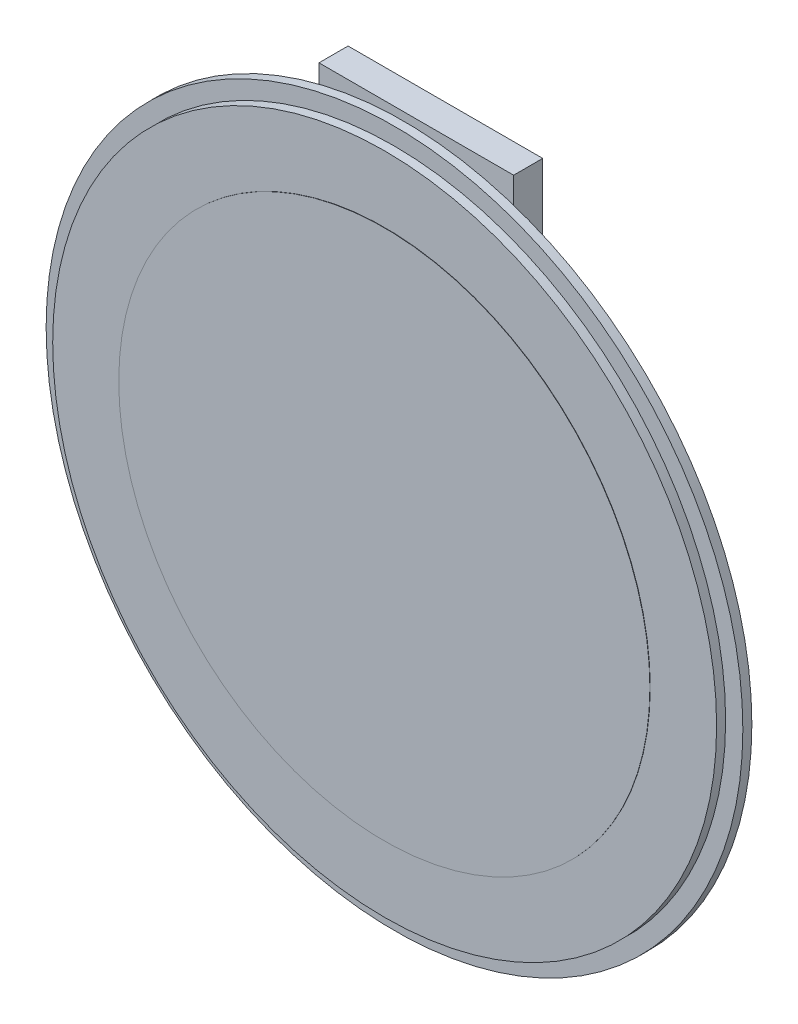
from build123d import *

# Parameters (mm, degrees)
SKETCH_1_R           = 21.25
EXTRUDE_2_DEPTH      = 0.55
EXTRUDE_START        = 0.05
SKETCH_4_R           = 20.25
EXTRUDE_5_DEPTH      = 0.55
EXTRUDE_6_DEPTH      = 1.85
SKETCH_13_W          = 12.14
SKETCH_13_H          = 0.25
SKETCH_15_W          = 1
SKETCH_15_H          = 13.8825
SKETCH_15_W_2        = 3.14
SKETCH_15_H_2        = 30.3825
CUT_EXTRUDE_1_DEPTH  = 0.25
FILLET_3_R           = 0.35
CUT_EXTRUDE_2_DEPTH  = 12.14
FILLET_4_R           = 0.03
EXTRUDE_9_DEPTH      = 0.8
EXTRUDE_9_DEPTH_BACK = 0.975
SKETCH_21_W          = 11.873363282
SKETCH_21_H          = 5.414826094
SKETCH_22_W          = 8.257682068
SKETCH_22_H          = 12
EXTRUDE_10_DEPTH     = 0.6
SKETCH_5_R           = 16.2
EXTRUDE_11_DEPTH     = 0.02


with BuildPart() as part:
    # 草图1 → 凸台-拉伸2 (new body)
    with BuildSketch(Plane.XY):
        Circle(SKETCH_1_R)
    extrude(amount=EXTRUDE_2_DEPTH)

    # 草图12 → 凸台-拉伸6 (add)
    with BuildSketch(Plane(origin=(0, 0, 0), x_dir=(-1, 0, 0), z_dir=(0, 0, -1))):
        with BuildLine():
            ThreePointArc((-7.141650725, -18.511776412), (-8.079107583, -16.663144613), (-9.429913307, -15.091015871))
            ThreePointArc((-9.429913307, -15.091015871), (0, 17.795), (9.429913307, -15.091015871))
            ThreePointArc((9.429913307, -15.091015871), (8.079107583, -16.663144613), (7.141650725, -18.511776412))
            Line((7.141650725, -18.511776412), (6.62, -19.945))
            Line((6.62, -19.945), (-6.62, -19.945))
            Line((-6.62, -19.945), (-7.141650725, -18.511776412))
        make_face()
    extrude(amount=EXTRUDE_6_DEPTH)

    # 扫描2: sweep along a path in 草图14
    with BuildLine(Plane(origin=(0, 0, 0), x_dir=(0, 0, -1), z_dir=(1, 0, 0))) as sweep_2_path:
        Line((1.375, -19.945), (1.375, -20.5875))
        ThreePointArc((1.375, -20.5875), (2.0375, -21.25), (2.7, -20.5875))
        Line((2.7, -20.5875), (2.7, 17.795))
    # 草图13 → 扫描2 (sweep)
    with BuildSketch(Plane.XZ.offset(19.945)):
        with Locations((0, -1.375)):
            Rectangle(SKETCH_13_W, SKETCH_13_H)
    sweep(path=sweep_2_path.line)

    # 草图15 → 切除-拉伸1 (cut)
    with BuildSketch(Plane(origin=(0, 0, -2.825), x_dir=(-1, 0, 0), z_dir=(0, 0, -1))):
        with Locations((5.57, 10.85375)):
            Rectangle(SKETCH_15_W, SKETCH_15_H)
        with Locations((-4.5, 2.60375)):
            Rectangle(SKETCH_15_W_2, SKETCH_15_H_2)
    extrude(amount=-CUT_EXTRUDE_1_DEPTH, mode=Mode.SUBTRACT)

    # 圆角3
    fillet_3_edges = [part.edges().sort_by_distance(p)[0] for p in [
        (-6.07, 3.9125, -2.7),
        (-5.07, 17.795, -2.7),
        (-5.07, 3.9125, -2.7),
        (2.93, 17.795, -2.7),
        (6.07, -12.5875, -2.7),
        (2.93, -12.5875, -2.7),
    ]]
    fillet(fillet_3_edges, radius=FILLET_3_R)

    # 草图18 → 切除-拉伸2 (cut)
    with BuildSketch(Plane(origin=(6.07, 0, 0), x_dir=(0, 0, -1), z_dir=(1, 0, 0))):
        with BuildLine():
            ThreePointArc((1.4375, -20.5875), (2.0375, -21.1875), (2.6375, -20.5875))
            Line((2.6375, -20.5875), (2.575, -20.5875))
            ThreePointArc((2.575, -20.5875), (2.0375, -21.125), (1.5, -20.5875))
            Line((1.5, -20.5875), (1.4375, -20.5875))
        make_face()
        with BuildLine():
            ThreePointArc((1.25, -20.5875), (2.0375, -21.375), (2.825, -20.5875))
            Line((2.825, -20.5875), (2.7375, -20.5875))
            ThreePointArc((2.7375, -20.5875), (2.0375, -21.2875), (1.3375, -20.5875))
            Line((1.3375, -20.5875), (1.25, -20.5875))
        make_face()
    extrude(amount=-CUT_EXTRUDE_2_DEPTH, mode=Mode.SUBTRACT)

    # 圆角4
    fillet_4_edges = [part.edges().sort_by_distance(p)[0] for p in [
        (0, -20.5875, -2.7375),
        (0, -20.5875, -1.3375),
        (0, -20.5875, -1.4375),
        (0, -20.5875, -2.6375),
        (0, -20.5875, -1.5),
        (0, -20.5875, -1.25),
        (0, -20.5875, -2.575),
        (0, -20.5875, -2.825),
    ]]
    fillet(fillet_4_edges, radius=FILLET_4_R)

    # 草图22 → 凸台-拉伸10 (add)
    with BuildSketch(Plane(origin=(0, 0, -2.825), x_dir=(-1, 0, 0), z_dir=(0, 0, -1))):
        with Locations((1.591158966, -2.4375)):
            Rectangle(SKETCH_22_W, SKETCH_22_H)
    extrude(amount=EXTRUDE_10_DEPTH)


with BuildPart() as body_2:
    # 草图4 → 凸台-拉伸5 (new body)
    with BuildSketch(Plane.XY.offset(0.55).offset(EXTRUDE_START)):
        Circle(SKETCH_4_R)
    extrude(amount=EXTRUDE_5_DEPTH)


with BuildPart() as body_3:
    # 草图21 → 凸台-拉伸9 (new, two sides: drawn at the far end of the back side and taken through both)
    with BuildSketch(Plane(origin=(0, 0, -2.825), x_dir=(-1, 0, 0), z_dir=(0, 0, -1)).offset(-EXTRUDE_9_DEPTH_BACK)):
        with Locations((1.07, 17.188379125)):
            Rectangle(SKETCH_21_W, SKETCH_21_H)
    extrude(amount=EXTRUDE_9_DEPTH + EXTRUDE_9_DEPTH_BACK)


with BuildPart() as body_4:
    # 草图5 → 凸台-拉伸11 (new body)
    with BuildSketch(Plane.XY.offset(1.15)):
        with Locations(Location((0, 0, 0), (0, 0, 180))):
            Circle(SKETCH_5_R)
    extrude(amount=EXTRUDE_11_DEPTH)


solid = Compound([part.part, body_2.part, body_3.part, body_4.part])
